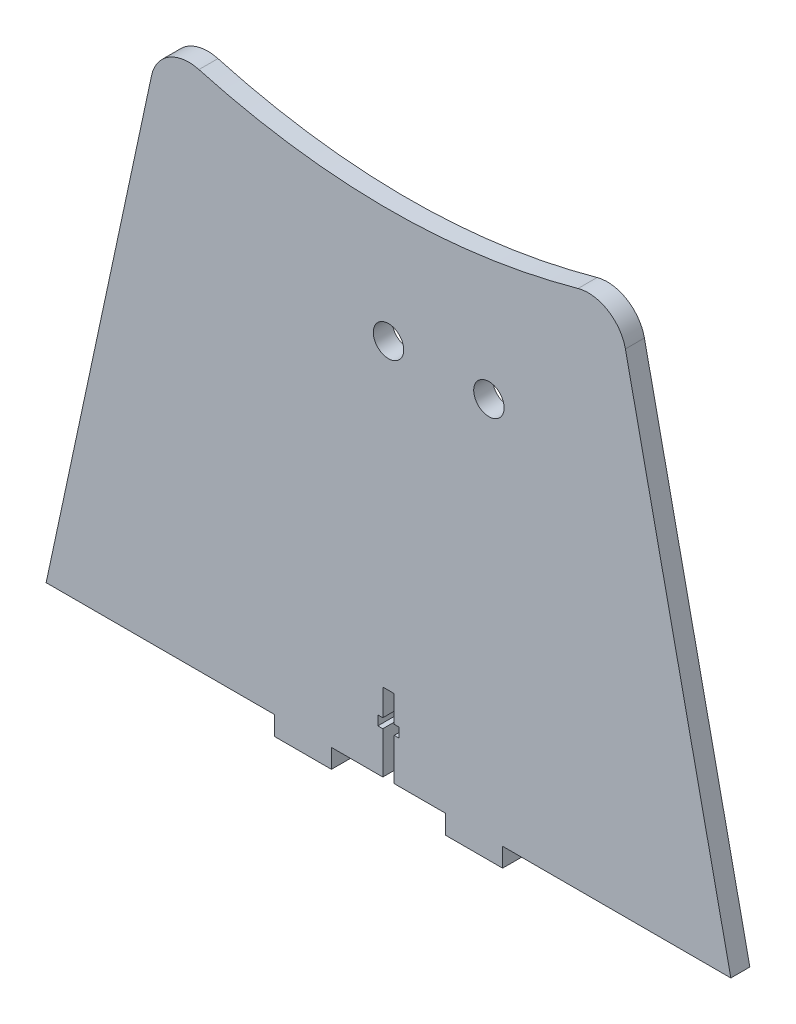
from build123d import *

# Parameters (mm, degrees)
SKETCH1_R           = 4
BOSS_EXTRUDE1_DEPTH = 5


with BuildPart() as part:
    # Sketch1 → Boss-Extrude1 (new body)
    with BuildSketch(Plane.XY):
        with BuildLine():
            Line((-29.957010387, -40.140273422), (-29.957010387, -45.140273422))
            Line((-29.957010387, -45.140273422), (-14.957010387, -45.140273422))
            Line((-14.957010387, -45.140273422), (-14.957010387, -40.140273422))
            Line((-14.957010387, -40.140273422), (-1.457010387, -40.140273422))
            Line((-1.457010387, -40.140273422), (-1.457010387, -29.140273422))
            Line((-1.457010387, -29.140273422), (-2.757010387, -29.140273422))
            Line((-2.757010387, -29.140273422), (-2.757010387, -26.640273422))
            Line((-2.757010387, -26.640273422), (-1.457010387, -26.640273422))
            Line((-1.457010387, -26.640273422), (-1.457010387, -19.640273422))
            Line((-1.457010387, -19.640273422), (1.542989613, -19.640273422))
            Line((1.542989613, -19.640273422), (1.542989613, -26.640273422))
            Line((1.542989613, -26.640273422), (2.842989613, -26.640273422))
            Line((2.842989613, -26.640273422), (2.842989613, -29.140273422))
            Line((2.842989613, -29.140273422), (1.542989613, -29.140273422))
            Line((1.542989613, -29.140273422), (1.542989613, -40.140273422))
            Line((1.542989613, -40.140273422), (15.042989613, -40.140273422))
            Line((15.042989613, -40.140273422), (15.042989613, -45.140273422))
            Line((15.042989613, -45.140273422), (30.042989613, -45.140273422))
            Line((30.042989613, -45.140273422), (30.042989613, -40.140273422))
            Line((30.042989613, -40.140273422), (90.042989613, -40.140273422))
            Line((90.042989613, -40.140273422), (62.323763373, 89.216115695))
            ThreePointArc((62.323763373, 89.216115695), (57.728251424, 95.673109145), (49.877526115, 96.75828499))
            add(Edge.make_bspline(
                [(49.877526115, 96.75828499), (33.266013947, 92.159246048), (0.042989613, 87.560207107), (-33.180034722, 92.159246048), (-49.791546889, 96.75828499)],
                knots=[0.084712196, 0.084712196, 0.084712196, 0.084712196, 0.5, 0.915287804, 0.915287804, 0.915287804, 0.915287804], degree=3))
            ThreePointArc((-49.791546889, 96.75828499), (-57.642272198, 95.673109145), (-62.237784148, 89.216115695))
            Line((-62.237784148, 89.216115695), (-89.957010387, -40.140273422))
            Line((-89.957010387, -40.140273422), (-29.957010387, -40.140273422))
        make_face()
        with Locations((26.442989613, 59.859726578)):
            Circle(SKETCH1_R, mode=Mode.SUBTRACT)
        with Locations((0.042989613, 59.859726578)):
            Circle(SKETCH1_R, mode=Mode.SUBTRACT)
    extrude(amount=BOSS_EXTRUDE1_DEPTH)


solid = part.part
